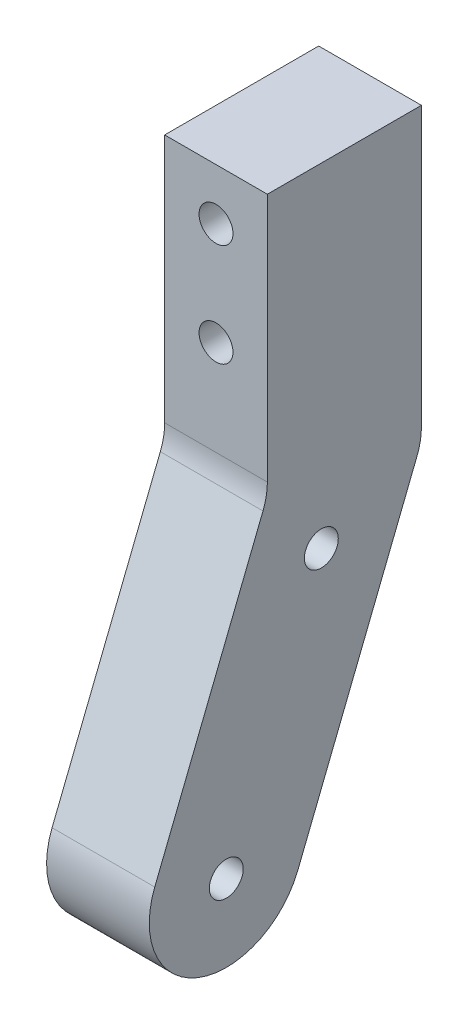
from build123d import *

# Parameters (mm, degrees)
SKETCH_1_W          = 64.494727868
SKETCH_1_H          = 65
SKETCH_1_R          = 1.65
EXTRUDE_1_DEPTH     = 10
SKETCH_2_R          = 1.65
CUT_EXTRUDE_1_DEPTH = 47.863018263
SKETCH_3_R          = 1.65
CUT_EXTRUDE_2_DEPTH = 44.110090197
FILLET_1_R          = 6


with BuildPart() as part:
    # ｽｹｯﾁ1 → ﾎﾞｽ - 押し出し1 (new body)
    with BuildSketch(Plane(origin=(0, 0, 0), x_dir=(0, 0, -1), z_dir=(1, 0, 0))):
        Rectangle(SKETCH_1_W, SKETCH_1_H)
        Circle(SKETCH_1_R, mode=Mode.SUBTRACT)
        with Locations((-9.255829981, -23.223471131)):
            Circle(SKETCH_1_R, mode=Mode.SUBTRACT)
        with Locations((-22.247363934, -11.404157049)):
            Circle(SKETCH_1_R, mode=Mode.SUBTRACT)
    extrude(amount=EXTRUDE_1_DEPTH)

    # ｽｹｯﾁ2 → ｶｯﾄ - 押し出し1 (cut, through all)
    with BuildSketch(Plane(origin=(10, 0, 0), x_dir=(0, 0, -1), z_dir=(1, 0, 0))):
        with BuildLine():
            Line((9.743790334, 32.5), (9.743790334, 4.190292345))
            Line((9.743790334, 4.190292345), (-2.288788642, -26.000220125))
            ThreePointArc((-2.288788642, -26.000220125), (-12.032578975, -30.19051247), (-16.22287132, -20.446722136))
            Line((-16.22287132, -20.446722136), (-5.256209666, 7.069335401))
            Line((-5.256209666, 7.069335401), (-5.256209666, 32.5))
            Line((-5.256209666, 32.5), (-32.247363934, 32.5))
            Line((-32.247363934, 32.5), (-32.247363934, -32.5))
            Line((-32.247363934, -32.5), (32.247363934, -32.5))
            Line((32.247363934, -32.5), (32.247363934, 32.5))
            Line((32.247363934, 32.5), (9.743790334, 32.5))
        make_face()
        with Locations((-22.247363934, -11.404157049)):
            Circle(SKETCH_2_R, mode=Mode.SUBTRACT)
    extrude(amount=-CUT_EXTRUDE_1_DEPTH, mode=Mode.SUBTRACT)

    # ｽｹｯﾁ3 → ｶｯﾄ - 押し出し2 (cut, through all)
    with BuildSketch(Plane(origin=(0, 0, -9.743790334), x_dir=(-1, 0, 0), z_dir=(0, 0, -1))):
        with Locations(Location((-5, 27.5, 0), (0, 0, 90))):
            Circle(SKETCH_3_R)
        with Locations(Location((-5, 17.5, 0), (0, 0, 90))):
            Circle(SKETCH_3_R)
    extrude(amount=-CUT_EXTRUDE_2_DEPTH, mode=Mode.SUBTRACT)

    # ﾌｨﾚｯﾄ1
    fillet_1_edges = [part.edges().sort_by_distance(p)[0] for p in [
        (5, 7.069335401, 5.256209666),
        (5, 4.190292345, -9.743790334),
    ]]
    fillet(fillet_1_edges, radius=FILLET_1_R)


solid = part.part
